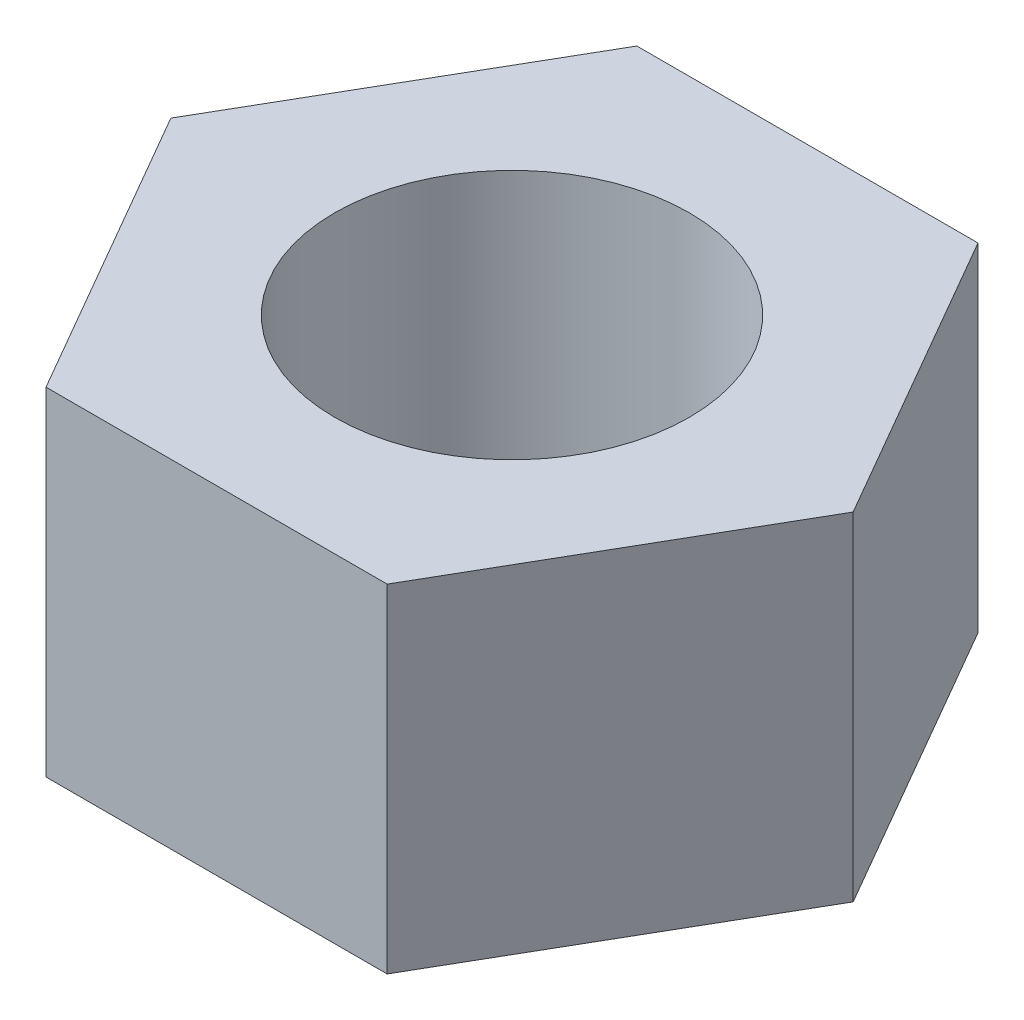
from build123d import *

# Parameters (mm, degrees)
SKETCH1_R           = 2.1
BOSS_EXTRUDE1_DEPTH = 4


with BuildPart() as part:
    # Sketch1 → Boss-Extrude1 (new body)
    with BuildSketch(Plane(origin=(0, 0, 0), x_dir=(1, 0, 0), z_dir=(0, 1, 0))):
        Polygon((4.041451884, 0), (2.020725942, 3.5), (-2.020725942, 3.5), (-4.041451884, 0), (-2.020725942, -3.5), (2.020725942, -3.5), align=None)
        with Locations(Location((0, 0, 0), (0, 0, 270))):
            Circle(SKETCH1_R, mode=Mode.SUBTRACT)
    extrude(amount=BOSS_EXTRUDE1_DEPTH)


solid = part.part
